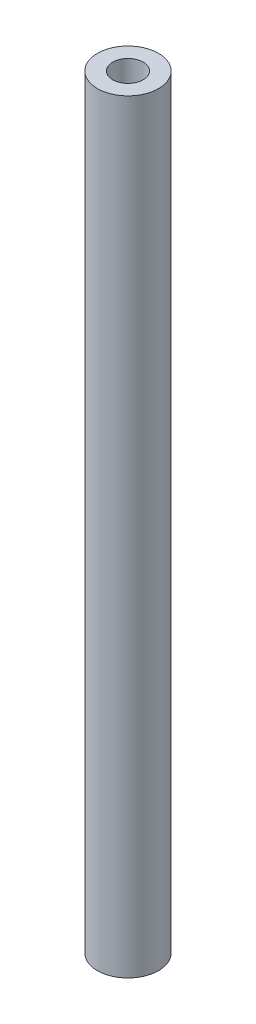
from build123d import *

# Parameters (mm, degrees)
SKETCH1_R           = 2
SKETCH1_R_2         = 1
BOSS_EXTRUDE1_DEPTH = 25


with BuildPart() as part:
    # Sketch1 → Boss-Extrude1 (new, symmetric)
    with BuildSketch(Plane(origin=(0, 0, 0), x_dir=(1, 0, 0), z_dir=(0, 1, 0))):
        with Locations(Location((0, 0, 0), (0, 0, 270))):
            Circle(SKETCH1_R)
        with Locations(Location((0, 0, 0), (0, 0, 270))):
            Circle(SKETCH1_R_2, mode=Mode.SUBTRACT)
    extrude(amount=BOSS_EXTRUDE1_DEPTH, both=True)


solid = part.part
